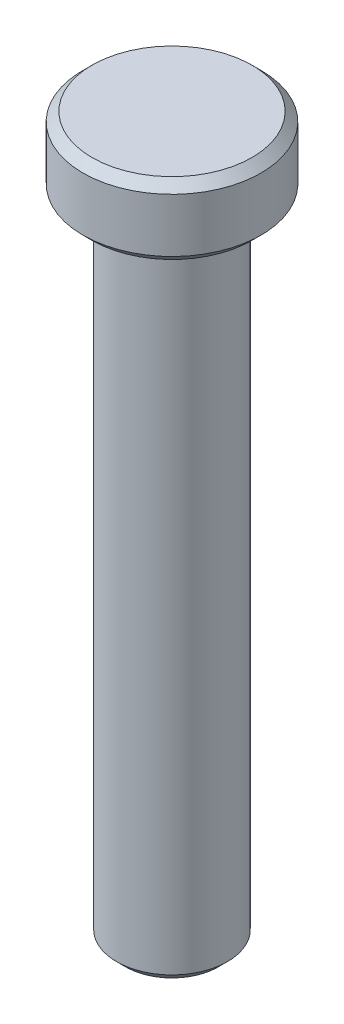
from build123d import *

# Parameters (mm, degrees)
SKETCH1_R           = 3.937
BOSS_EXTRUDE1_DEPTH = 1.5875
SKETCH2_R           = 2.4511
BOSS_EXTRUDE2_DEPTH = 28.575
CHAMFER1_SIZE       = 0.396875


with BuildPart() as part:
    # Sketch1 → Boss-Extrude1 (new, symmetric)
    with BuildSketch(Plane(origin=(0, 0, 0), x_dir=(1, 0, 0), z_dir=(0, 1, 0))):
        with Locations(Location((0, 0, 0), (0, 0, 270))):
            Circle(SKETCH1_R)
    extrude(amount=BOSS_EXTRUDE1_DEPTH, both=True)

    # Sketch2 → Boss-Extrude2 (add)
    with BuildSketch(Plane.XZ.offset(1.5875)):
        with Locations(Location((0, 0, 0), (0, 0, 270))):
            Circle(SKETCH2_R)
    extrude(amount=BOSS_EXTRUDE2_DEPTH)

    # Chamfer1
    chamfer1_edges = [part.edges().sort_by_distance(p)[0] for p in [
        (0, -1.5875, -3.937),
        (0, 1.5875, -3.937),
        (0, -30.1625, 2.4511),
    ]]
    chamfer(chamfer1_edges, length=CHAMFER1_SIZE)


solid = part.part
